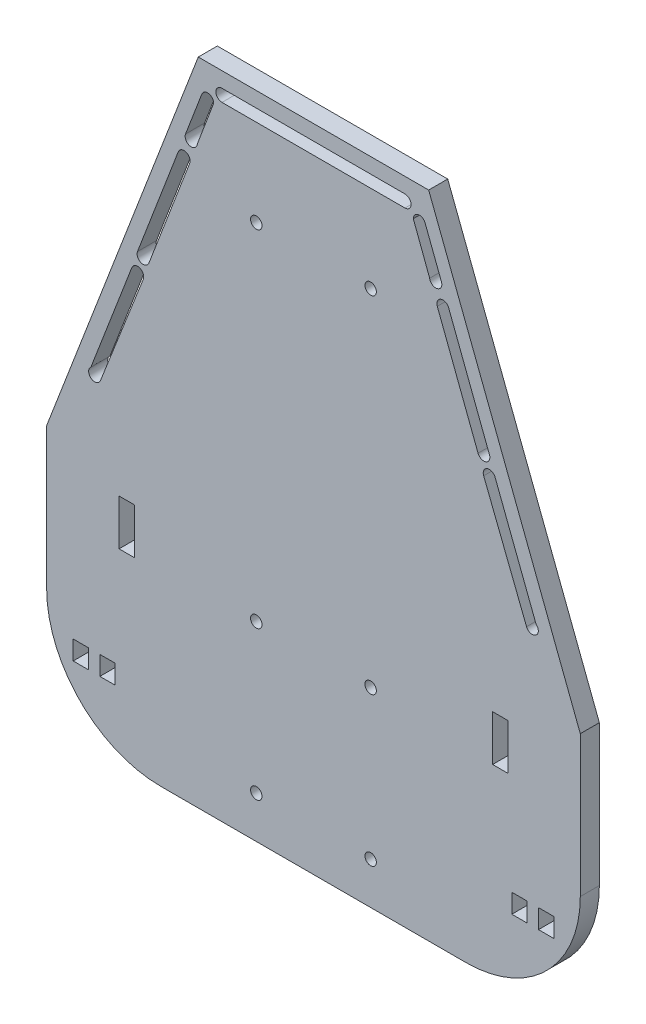
from build123d import *

# Parameters (mm, degrees)
BOSS_EXTRUDE2_DEPTH  = 1
SKETCH41_W           = 4
SKETCH41_H           = 5
SKETCH41_R           = 1.5
SKETCH41_H_2         = 12
CUT_EXTRUDE42_DEPTH  = 19
BOSS_EXTRUDE17_DEPTH = 4
SKETCH47_W           = 4
SKETCH47_H           = 5
SKETCH47_H_2         = 12
CUT_EXTRUDE47_DEPTH  = 185.495850796
SKETCH48_R           = 1.5
CUT_EXTRUDE44_DEPTH  = 185.495850796
BOSS_EXTRUDE18_START = -1
SKETCH51_R           = 1.5
BOSS_EXTRUDE18_DEPTH = 1
BOSS_EXTRUDE19_START = -2
SKETCH52_R           = 1.5
BOSS_EXTRUDE19_DEPTH = 2
SKETCH53_R           = 1.5
CUT_EXTRUDE46_DEPTH  = 185.495850796
BOSS_EXTRUDE20_START = -1
SKETCH55_R           = 1.5
BOSS_EXTRUDE20_DEPTH = 1
SKETCH58_R           = 1.5
CUT_EXTRUDE45_DEPTH  = 185.495850796


with BuildPart() as part:
    # Sketch2 → Boss-Extrude2 (new body)
    with BuildSketch(Plane.XY):
        with BuildLine():
            Line((0, 0), (40, 0))
            ThreePointArc((40, 0), (61.213203436, 8.786796564), (70, 30))
            Line((70, 30), (70, 67))
            Line((70, 67), (30.2211576, 170.627427341))
            Line((30.2211576, 170.627427341), (-30.2211576, 170.627427341))
            Line((-30.2211576, 170.627427341), (-70, 67))
            Line((-70, 67), (-70, 30))
            ThreePointArc((-70, 30), (-61.213203436, 8.786796564), (-40, 0))
            Line((-40, 0), (0, 0))
        make_face()
    extrude(amount=BOSS_EXTRUDE2_DEPTH)

    # Sketch41 → Cut-Extrude42 (cut)
    with BuildSketch(Plane.XY.offset(1)):
        with Locations((54.037011669, 19.5)):
            Rectangle(SKETCH41_W, SKETCH41_H)
        with Locations((-54.037011669, 19.5)):
            Rectangle(SKETCH41_W, SKETCH41_H)
        with Locations((-15, 65)):
            Circle(SKETCH41_R)
        with Locations((15, 65)):
            Circle(SKETCH41_R)
        with BuildLine():
            ThreePointArc((-55.895620015, 84.257333662), (-58.330916289, 83.551440528), (-58.390755847, 86.086272335))
            Line((-58.390755847, 86.086272335), (-47.63971736, 114.09368513))
            ThreePointArc((-47.63971736, 114.09368513), (-45.555710052, 115.00290606), (-44.646489123, 112.918898752))
            Line((-44.646489123, 112.918898752), (-55.895620015, 84.257333662))
        make_face()
        with BuildLine():
            ThreePointArc((-43.178836535, 117.313137537), (-45.24430647, 116.38910618), (-46.168337826, 118.454576116))
            Line((-46.168337826, 118.454576116), (-35.46735115, 146.481150722))
            ThreePointArc((-35.46735115, 146.481150722), (-33.401881215, 147.405182078), (-32.477849859, 145.339712143))
            Line((-32.477849859, 145.339712143), (-43.178836535, 117.313137537))
        make_face()
        with BuildLine():
            ThreePointArc((24, 166.627427341), (25.6, 165.027427341), (24, 163.427427341))
            Line((24, 163.427427341), (-24, 163.427427341))
            ThreePointArc((-24, 163.427427341), (-25.6, 165.027427341), (-24, 166.627427341))
            Line((-24, 166.627427341), (24, 166.627427341))
        make_face()
        with BuildLine():
            ThreePointArc((33.563613753, 151.467161805), (32.441986519, 149.340557263), (30.477844504, 150.727150454))
            Line((30.477844504, 150.727150454), (26.188468437, 162.107072358))
            ThreePointArc((26.188468437, 162.107072358), (27.498296965, 163.680540031), (29.283219083, 162.677791648))
            Line((29.283219083, 162.677791648), (33.563613753, 151.467161805))
        make_face()
        with BuildLine():
            Line((55.895620015, 84.257333662), (44.646489123, 112.918898752))
            ThreePointArc((44.646489123, 112.918898752), (45.555710052, 115.00290606), (47.63971736, 114.09368513))
            Line((47.63971736, 114.09368513), (58.390755847, 86.086272335))
            ThreePointArc((58.390755847, 86.086272335), (58.330916289, 83.551440528), (55.895620015, 84.257333662))
        make_face()
        with Locations((-15, 140.627427341)):
            Circle(SKETCH41_R)
        with Locations((15, 140.627427341)):
            Circle(SKETCH41_R)
        with Locations((49, 54.5)):
            Rectangle(SKETCH41_W, SKETCH41_H_2)
        with Locations((-49, 54.5)):
            Rectangle(SKETCH41_W, SKETCH41_H_2)
        with Locations((61.037011669, 19.5)):
            Rectangle(SKETCH41_W, SKETCH41_H)
        with Locations(Location((15, 15, 0), (0, 0, 180))):
            Circle(SKETCH41_R)
        with Locations((-15, 15)):
            Circle(SKETCH41_R)
        with Locations((-61.037011669, 19.5)):
            Rectangle(SKETCH41_W, SKETCH41_H)
        with BuildLine():
            Line((-33.563613753, 151.467161805), (-29.283219083, 162.677791648))
            ThreePointArc((-29.283219083, 162.677791648), (-27.498296965, 163.680540031), (-26.188468437, 162.107072358))
            Line((-26.188468437, 162.107072358), (-30.477844504, 150.727150454))
            ThreePointArc((-30.477844504, 150.727150454), (-32.441986519, 149.340557263), (-33.563613753, 151.467161805))
        make_face()
        with BuildLine():
            Line((35.46735115, 146.481150722), (46.168337826, 118.454576116))
            ThreePointArc((46.168337826, 118.454576116), (45.24430647, 116.38910618), (43.178836535, 117.313137537))
            Line((43.178836535, 117.313137537), (32.477849859, 145.339712143))
            ThreePointArc((32.477849859, 145.339712143), (33.401881215, 147.405182078), (35.46735115, 146.481150722))
        make_face()
    extrude(amount=-CUT_EXTRUDE42_DEPTH, mode=Mode.SUBTRACT)

    # Sketch42 → Boss-Extrude17 (add)
    with BuildSketch(Plane.XY.offset(1)):
        with BuildLine():
            Line((-40, 0), (40, 0))
            ThreePointArc((40, 0), (61.213203436, 8.786796564), (70, 30))
            Line((70, 30), (70, 67))
            Line((70, 67), (30.2211576, 170.627427341))
            Line((30.2211576, 170.627427341), (-30.2211576, 170.627427341))
            Line((-30.2211576, 170.627427341), (-70, 67))
            Line((-70, 67), (-70, 30))
            ThreePointArc((-70, 30), (-61.213203436, 8.786796564), (-40, 0))
        make_face()
    extrude(amount=BOSS_EXTRUDE17_DEPTH)

    # Sketch47 → Cut-Extrude47 (cut, through all)
    with BuildSketch(Plane(origin=(0, 0, 0), x_dir=(-1, 0, 0), z_dir=(0, 0, -1))):
        with Locations((61.037011669, 19.5)):
            Rectangle(SKETCH47_W, SKETCH47_H)
        with Locations((54.037011669, 19.5)):
            Rectangle(SKETCH47_W, SKETCH47_H)
        with Locations((-54.037011669, 19.5)):
            Rectangle(SKETCH47_W, SKETCH47_H)
        with Locations((-61.037011669, 19.5)):
            Rectangle(SKETCH47_W, SKETCH47_H)
        with Locations((-49, 54.5)):
            Rectangle(SKETCH47_W, SKETCH47_H_2)
        with Locations((49, 54.5)):
            Rectangle(SKETCH47_W, SKETCH47_H_2)
    extrude(amount=-CUT_EXTRUDE47_DEPTH, mode=Mode.SUBTRACT)

    # Sketch48 → Cut-Extrude44 (cut, through all)
    with BuildSketch(Plane(origin=(0, 0, 0), x_dir=(-1, 0, 0), z_dir=(0, 0, -1))):
        with Locations((-15, 140.627427341)):
            Circle(SKETCH48_R)
        with Locations((15, 140.627427341)):
            Circle(SKETCH48_R)
        with BuildLine():
            Line((-43.178836535, 117.313137537), (-32.477849859, 145.339712143))
            ThreePointArc((-32.477849859, 145.339712143), (-33.401881215, 147.405182078), (-35.46735115, 146.481150722))
            Line((-35.46735115, 146.481150722), (-46.168337826, 118.454576116))
            ThreePointArc((-46.168337826, 118.454576116), (-45.24430647, 116.38910618), (-43.178836535, 117.313137537))
        make_face()
        with BuildLine():
            Line((-55.895620015, 84.257333662), (-44.646489123, 112.918898752))
            ThreePointArc((-44.646489123, 112.918898752), (-45.555710052, 115.00290606), (-47.63971736, 114.09368513))
            Line((-47.63971736, 114.09368513), (-58.390755847, 86.086272335))
            ThreePointArc((-58.390755847, 86.086272335), (-58.330916289, 83.551440528), (-55.895620015, 84.257333662))
        make_face()
        with BuildLine():
            Line((-30.477844504, 150.727150454), (-26.188468437, 162.107072358))
            ThreePointArc((-26.188468437, 162.107072358), (-27.498296965, 163.680540031), (-29.283219083, 162.677791648))
            Line((-29.283219083, 162.677791648), (-33.563613753, 151.467161805))
            ThreePointArc((-33.563613753, 151.467161805), (-32.441986519, 149.340557263), (-30.477844504, 150.727150454))
        make_face()
        with BuildLine():
            Line((-24, 163.427427341), (24, 163.427427341))
            ThreePointArc((24, 163.427427341), (25.6, 165.027427341), (24, 166.627427341))
            Line((24, 166.627427341), (-24, 166.627427341))
            ThreePointArc((-24, 166.627427341), (-25.6, 165.027427341), (-24, 163.427427341))
        make_face()
        with BuildLine():
            Line((26.188468437, 162.107072358), (30.477844504, 150.727150454))
            ThreePointArc((30.477844504, 150.727150454), (32.441986519, 149.340557263), (33.563613753, 151.467161805))
            Line((33.563613753, 151.467161805), (29.283219083, 162.677791648))
            ThreePointArc((29.283219083, 162.677791648), (27.498296965, 163.680540031), (26.188468437, 162.107072358))
        make_face()
        with BuildLine():
            Line((46.168337826, 118.454576116), (35.46735115, 146.481150722))
            ThreePointArc((35.46735115, 146.481150722), (33.401881215, 147.405182078), (32.477849859, 145.339712143))
            Line((32.477849859, 145.339712143), (43.178836535, 117.313137537))
            ThreePointArc((43.178836535, 117.313137537), (45.24430647, 116.38910618), (46.168337826, 118.454576116))
        make_face()
        with BuildLine():
            Line((58.390755847, 86.086272335), (47.63971736, 114.09368513))
            ThreePointArc((47.63971736, 114.09368513), (45.555710052, 115.00290606), (44.646489123, 112.918898752))
            Line((44.646489123, 112.918898752), (55.895620015, 84.257333662))
            ThreePointArc((55.895620015, 84.257333662), (58.330916289, 83.551440528), (58.390755847, 86.086272335))
        make_face()
    extrude(amount=-CUT_EXTRUDE44_DEPTH, mode=Mode.SUBTRACT)

    # Sketch51 → Boss-Extrude18 (add)
    with BuildSketch(Plane(origin=(0, 0, 0), x_dir=(-1, 0, 0), z_dir=(0, 0, -1)).offset(BOSS_EXTRUDE18_START)):
        with Locations((-15, 65)):
            Circle(SKETCH51_R)
    extrude(amount=BOSS_EXTRUDE18_DEPTH)

    # Sketch52 → Boss-Extrude19 (add)
    with BuildSketch(Plane(origin=(0, 0, 0), x_dir=(-1, 0, 0), z_dir=(0, 0, -1)).offset(BOSS_EXTRUDE19_START)):
        with Locations((15, 65)):
            Circle(SKETCH52_R)
    extrude(amount=BOSS_EXTRUDE19_DEPTH)

    # Sketch53 → Cut-Extrude46 (cut, through all)
    with BuildSketch(Plane.XY.offset(5)):
        with Locations((-15, 50)):
            Circle(SKETCH53_R)
        with Locations((15, 50)):
            Circle(SKETCH53_R)
    extrude(amount=-CUT_EXTRUDE46_DEPTH, mode=Mode.SUBTRACT)

    # Sketch55 → Boss-Extrude20 (add)
    with BuildSketch(Plane(origin=(0, 0, 0), x_dir=(-1, 0, 0), z_dir=(0, 0, -1)).offset(BOSS_EXTRUDE20_START)):
        with Locations((-15, 15)):
            Circle(SKETCH55_R)
        with Locations((15, 15)):
            Circle(SKETCH55_R)
    extrude(amount=BOSS_EXTRUDE20_DEPTH)

    # Sketch58 → Cut-Extrude45 (cut, through all)
    with BuildSketch(Plane(origin=(0, 0, 0), x_dir=(-1, 0, 0), z_dir=(0, 0, -1))):
        with Locations((-15, 11)):
            Circle(SKETCH58_R)
        with Locations((15, 11)):
            Circle(SKETCH58_R)
    extrude(amount=-CUT_EXTRUDE45_DEPTH, mode=Mode.SUBTRACT)


solid = part.part
